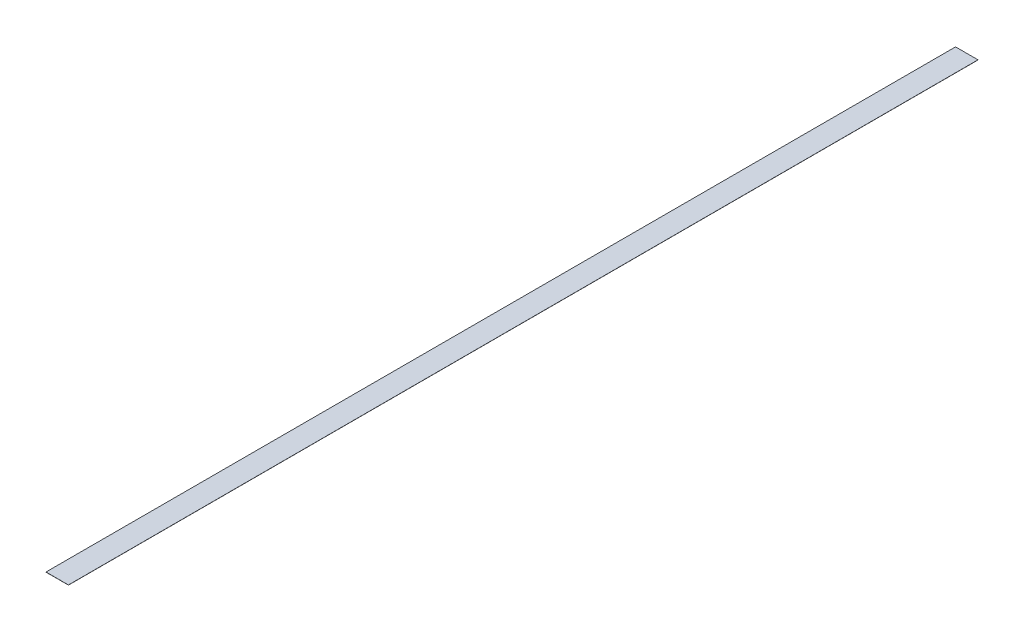
from build123d import *

# Parameters (mm, degrees)
SKETCH1_W           = 15
SKETCH1_H           = 608
BOSS_EXTRUDE1_DEPTH = 0.1


with BuildPart() as part:
    # Sketch1 → Boss-Extrude1 (new body)
    with BuildSketch(Plane(origin=(0, 0, 0), x_dir=(1, 0, 0), z_dir=(0, 1, 0))):
        with Locations((7.5, -304)):
            Rectangle(SKETCH1_W, SKETCH1_H)
    extrude(amount=BOSS_EXTRUDE1_DEPTH)


solid = part.part
